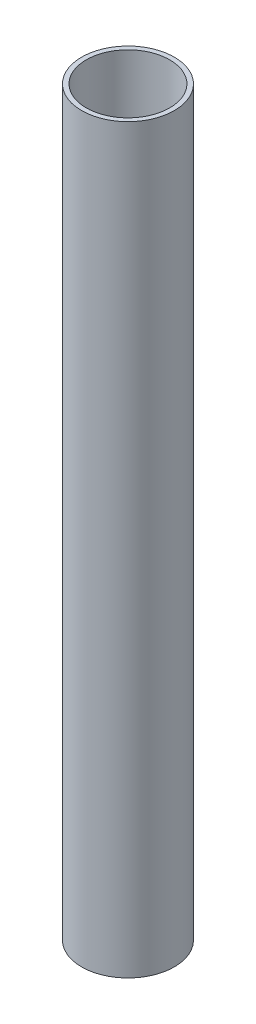
from build123d import *

# Parameters (mm, degrees)
SKETCH_1_R   = 10
SKETCH_1_R_2 = 9
F_1MM_DEPTH  = 80


with BuildPart() as part:
    # 草图1 → 1mm (new, symmetric)
    with BuildSketch(Plane(origin=(0, 0, 0), x_dir=(1, 0, 0), z_dir=(0, 1, 0))):
        Circle(SKETCH_1_R)
        Circle(SKETCH_1_R_2, mode=Mode.SUBTRACT)
    extrude(amount=F_1MM_DEPTH, both=True)


solid = part.part
